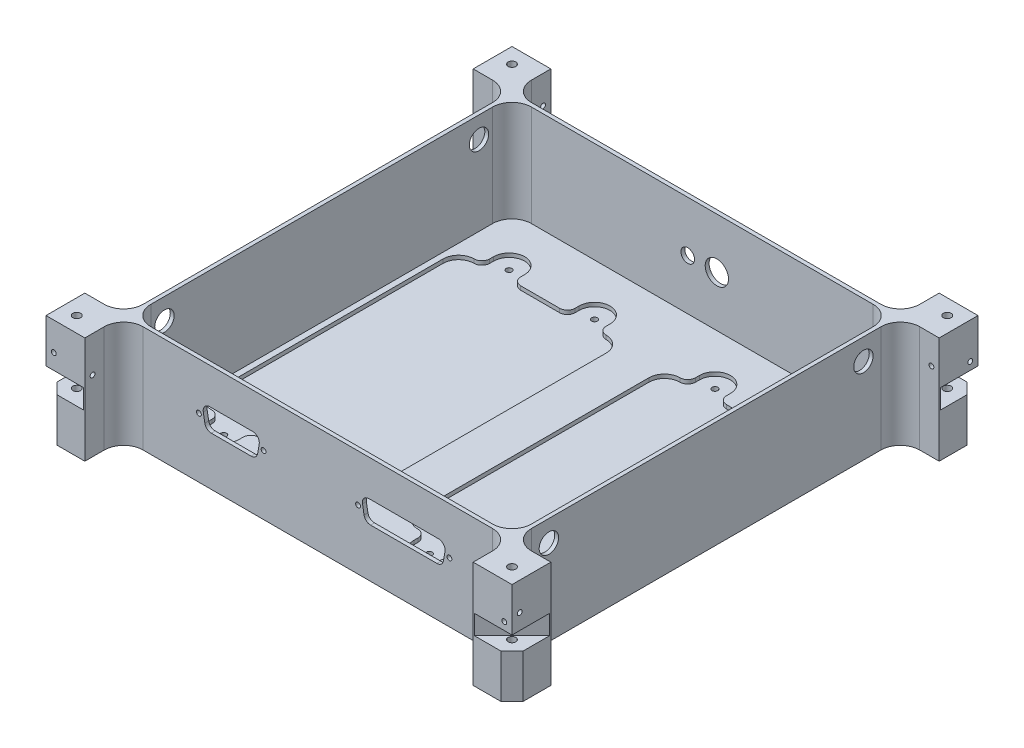
from build123d import *

# Parameters (mm, degrees)
BOSS_EXTRUDE1_DEPTH        = 27.5
CUT_EXTRUDE1_DEPTH         = 52
SKETCH3_R                  = 1.5
CUT_EXTRUDE2_DEPTH         = 2
BOSS_EXTRUDE2_DEPTH        = 2
CUT_EXTRUDE3_REACH         = 179.494
SKETCH3_3_R                = 1.5
CUT_EXTRUDE4_DEPTH         = 2
F_3_0_3_DIAMETER_HOLE1_D   = 3
F_10_0_10_DIAMETER_HOLE1_D = 10
CUT_EXTRUDE5_DEPTH         = 22.5
CIRPATTERN1_COUNT          = 4
CUT_EXTRUDE6_DEPTH         = 10
CIRPATTERN2_COUNT          = 4
CUT_EXTRUDE7_REACH         = 254.33
SKETCH18_R                 = 6
SKETCH18_R_2               = 3.5
SKETCH22_R                 = 2
CUT_EXTRUDE8_DEPTH         = 180.022344974
CIRPATTERN3_COUNT          = 4
M3X0_5_TAPPED_HOLE1_D      = 2.5
M3X0_5_TAPPED_HOLE1_DEPTH  = 20
M3X0_5_TAPPED_HOLE1_TIP    = 0.751075774
M3X0_5_TAPPED_HOLE2_D      = 2.5
M3X0_5_TAPPED_HOLE2_DEPTH  = 21.5
M3X0_5_TAPPED_HOLE2_TIP    = 0.751075774
M3X0_5_TAPPED_HOLE3_D      = 2.5
M3X0_5_TAPPED_HOLE3_DEPTH  = 21.5
M3X0_5_TAPPED_HOLE3_TIP    = 0.751075774
M3X0_5_TAPPED_HOLE4_D      = 2.5
M3X0_5_TAPPED_HOLE4_DEPTH  = 21.5
M3X0_5_TAPPED_HOLE4_TIP    = 0.751075774
CUT_EXTRUDE9_DEPTH         = 10
M3X0_5_TAPPED_HOLE5_D      = 2.5
M3X0_5_TAPPED_HOLE5_DEPTH  = 4
M3X0_5_TAPPED_HOLE5_TIP    = 0.751075774


with BuildPart() as part:
    # Sketch1 → Boss-Extrude1 (new, symmetric)
    with BuildSketch(Plane(origin=(0, 0, 0), x_dir=(1, 0, 0), z_dir=(0, 1, 0))):
        with BuildLine():
            Line((-100, 120), (-120, 120))
            Line((-120, 120), (-120, 100))
            Line((-120, 100), (-110, 100))
            ThreePointArc((-110, 100), (-102.928932188, 97.071067812), (-100, 90))
            Line((-100, 90), (-100, -90))
            ThreePointArc((-100, -90), (-102.928932188, -97.071067812), (-110, -100))
            Line((-110, -100), (-120, -100))
            Line((-120, -100), (-120, -120))
            Line((-120, -120), (-100, -120))
            Line((-100, -120), (-100, -110))
            ThreePointArc((-100, -110), (-97.071067812, -102.928932188), (-90, -100))
            Line((-90, -100), (90, -100))
            ThreePointArc((90, -100), (97.071067812, -102.928932188), (100, -110))
            Line((100, -110), (100, -120))
            Line((100, -120), (120, -120))
            Line((120, -120), (120, -100))
            Line((120, -100), (110, -100))
            ThreePointArc((110, -100), (102.928932188, -97.071067812), (100, -90))
            Line((100, -90), (100, 90))
            ThreePointArc((100, 90), (102.928932188, 97.071067812), (110, 100))
            Line((110, 100), (120, 100))
            Line((120, 100), (120, 120))
            Line((120, 120), (100, 120))
            Line((100, 120), (100, 110))
            ThreePointArc((100, 110), (97.071067812, 102.928932188), (90, 100))
            Line((90, 100), (-90, 100))
            ThreePointArc((-90, 100), (-97.071067812, 102.928932188), (-100, 110))
            Line((-100, 110), (-100, 120))
        make_face()
    extrude(amount=BOSS_EXTRUDE1_DEPTH, both=True)

    # Sketch2 → Cut-Extrude1 (cut)
    with BuildSketch(Plane(origin=(0, 27.5, 0), x_dir=(1, 0, 0), z_dir=(0, 1, 0))):
        with BuildLine():
            Line((-88, 98), (88, 98))
            ThreePointArc((88, 98), (95.071067812, 95.071067812), (98, 88))
            Line((98, 88), (98, -88))
            ThreePointArc((98, -88), (95.071067812, -95.071067812), (88, -98))
            Line((88, -98), (-88, -98))
            ThreePointArc((-88, -98), (-95.071067812, -95.071067812), (-98, -88))
            Line((-98, -88), (-98, 88))
            ThreePointArc((-98, 88), (-95.071067812, 95.071067812), (-88, 98))
        make_face()
    extrude(amount=-CUT_EXTRUDE1_DEPTH, mode=Mode.SUBTRACT)

    # Sketch3 → Cut-Extrude2 (cut)
    # profile 1 of 2: a face of its own
    with BuildSketch(Plane(origin=(0, -24.5, 0), x_dir=(1, 0, 0), z_dir=(0, 1, 0))):
        with BuildLine():
            ThreePointArc((-83, 71.5), (-84.171572875, 68.671572875), (-87, 67.5))
            ThreePointArc((-87, 67.5), (-92.656854249, 65.156854249), (-95, 59.5))
            Line((-95, 59.5), (-95, -59.5))
            ThreePointArc((-95, -59.5), (-92.656854249, -65.156854249), (-87, -67.5))
            ThreePointArc((-87, -67.5), (-84.171572875, -68.671572875), (-83, -71.5))
            Line((-83, -71.5), (-83, -73.5))
            ThreePointArc((-83, -73.5), (-75, -81.5), (-67, -73.5))
            Line((-67, -73.5), (-67, -71.5))
            ThreePointArc((-67, -71.5), (-65.828427125, -68.671572875), (-63, -67.5))
            Line((-63, -67.5), (-43, -67.5))
            ThreePointArc((-43, -67.5), (-40.171572875, -68.671572875), (-39, -71.5))
            Line((-39, -71.5), (-39, -73.5))
            ThreePointArc((-39, -73.5), (-31, -81.5), (-23, -73.5))
            Line((-23, -73.5), (-23, -71.5))
            ThreePointArc((-23, -71.5), (-21.828427125, -68.671572875), (-19, -67.5))
            ThreePointArc((-19, -67.5), (-13.343145751, -65.156854249), (-11, -59.5))
            Line((-11, -59.5), (-11, 59.5))
            ThreePointArc((-11, 59.5), (-13.343145751, 65.156854249), (-19, 67.5))
            ThreePointArc((-19, 67.5), (-21.828427125, 68.671572875), (-23, 71.5))
            Line((-23, 71.5), (-23, 73.5))
            ThreePointArc((-23, 73.5), (-31, 81.5), (-39, 73.5))
            Line((-39, 73.5), (-39, 71.5))
            ThreePointArc((-39, 71.5), (-40.171572875, 68.671572875), (-43, 67.5))
            Line((-43, 67.5), (-63, 67.5))
            ThreePointArc((-63, 67.5), (-65.828427125, 68.671572875), (-67, 71.5))
            Line((-67, 71.5), (-67, 73.5))
            ThreePointArc((-67, 73.5), (-75, 81.5), (-83, 73.5))
            Line((-83, 73.5), (-83, 71.5))
        make_face()
        with Locations(Location((-75, -73.5, 0), (0, 0, 270))):
            Circle(SKETCH3_R, mode=Mode.SUBTRACT)
        with Locations(Location((-31, -73.5, 0), (0, 0, 270))):
            Circle(SKETCH3_R, mode=Mode.SUBTRACT)
        with Locations(Location((-75, 73.5, 0), (0, 0, 270))):
            Circle(SKETCH3_R, mode=Mode.SUBTRACT)
        with Locations(Location((-31, 73.5, 0), (0, 0, 270))):
            Circle(SKETCH3_R, mode=Mode.SUBTRACT)
    # profile 2 of 2: a face of its own
    with BuildSketch(Plane(origin=(0, -24.5, 0), x_dir=(1, 0, 0), z_dir=(0, 1, 0))):
        with BuildLine():
            ThreePointArc((23, 71.5), (21.828427125, 68.671572875), (19, 67.5))
            ThreePointArc((19, 67.5), (13.343145751, 65.156854249), (11, 59.5))
            Line((11, 59.5), (11, -59.5))
            ThreePointArc((11, -59.5), (13.343145751, -65.156854249), (19, -67.5))
            ThreePointArc((19, -67.5), (21.828427125, -68.671572875), (23, -71.5))
            Line((23, -71.5), (23, -73.5))
            ThreePointArc((23, -73.5), (31, -81.5), (39, -73.5))
            Line((39, -73.5), (39, -71.5))
            ThreePointArc((39, -71.5), (40.171572875, -68.671572875), (43, -67.5))
            Line((43, -67.5), (63, -67.5))
            ThreePointArc((63, -67.5), (65.828427125, -68.671572875), (67, -71.5))
            Line((67, -71.5), (67, -73.5))
            ThreePointArc((67, -73.5), (75, -81.5), (83, -73.5))
            Line((83, -73.5), (83, -71.5))
            ThreePointArc((83, -71.5), (84.171572875, -68.671572875), (87, -67.5))
            ThreePointArc((87, -67.5), (92.656854249, -65.156854249), (95, -59.5))
            Line((95, -59.5), (95, 59.5))
            ThreePointArc((95, 59.5), (92.656854249, 65.156854249), (87, 67.5))
            ThreePointArc((87, 67.5), (84.171572875, 68.671572875), (83, 71.5))
            Line((83, 71.5), (83, 73.5))
            ThreePointArc((83, 73.5), (75, 81.5), (67, 73.5))
            Line((67, 73.5), (67, 71.5))
            ThreePointArc((67, 71.5), (65.828427125, 68.671572875), (63, 67.5))
            Line((63, 67.5), (43, 67.5))
            ThreePointArc((43, 67.5), (40.171572875, 68.671572875), (39, 71.5))
            Line((39, 71.5), (39, 73.5))
            ThreePointArc((39, 73.5), (31, 81.5), (23, 73.5))
            Line((23, 73.5), (23, 71.5))
        make_face()
        with Locations(Location((31, -73.5, 0), (0, 0, 270))):
            Circle(SKETCH3_R, mode=Mode.SUBTRACT)
        with Locations(Location((75, -73.5, 0), (0, 0, 270))):
            Circle(SKETCH3_R, mode=Mode.SUBTRACT)
        with Locations(Location((31, 73.5, 0), (0, 0, 270))):
            Circle(SKETCH3_R, mode=Mode.SUBTRACT)
        with Locations(Location((75, 73.5, 0), (0, 0, 270))):
            Circle(SKETCH3_R, mode=Mode.SUBTRACT)
    extrude(amount=-CUT_EXTRUDE2_DEPTH, mode=Mode.SUBTRACT)

    # Sketch5 → Boss-Extrude2 (add)
    with BuildSketch(Plane.XZ.offset(27.5)):
        with BuildLine():
            Line((-88, 98), (88, 98))
            ThreePointArc((88, 98), (95.071067812, 95.071067812), (98, 88))
            Line((98, 88), (98, -88))
            ThreePointArc((98, -88), (95.071067812, -95.071067812), (88, -98))
            Line((88, -98), (-88, -98))
            ThreePointArc((-88, -98), (-95.071067812, -95.071067812), (-98, -88))
            Line((-98, -88), (-98, 88))
            ThreePointArc((-98, 88), (-95.071067812, 95.071067812), (-88, 98))
        make_face()
    extrude(amount=BOSS_EXTRUDE2_DEPTH)

    # Sketch3<3> → Cut-Extrude3 (cut, up to next)
    with BuildSketch(Plane(origin=(0, -24.5, 0), x_dir=(1, 0, 0), z_dir=(0, 1, 0)), mode=Mode.PRIVATE) as cut_extrude3_sk1:
        with Locations(Location((-75, 73.5, 0), (0, 0, 270))):
            Circle(SKETCH3_3_R)
    cut_extrude3_tool1 = extrude(cut_extrude3_sk1.sketch, amount=-CUT_EXTRUDE3_REACH, mode=Mode.PRIVATE) & part.part
    # Sketch3<3> → Cut-Extrude3 (cut, up to next)
    with BuildSketch(Plane(origin=(0, -24.5, 0), x_dir=(1, 0, 0), z_dir=(0, 1, 0)), mode=Mode.PRIVATE) as cut_extrude3_sk2:
        with Locations(Location((-31, 73.5, 0), (0, 0, 270))):
            Circle(SKETCH3_3_R)
    cut_extrude3_tool2 = extrude(cut_extrude3_sk2.sketch, amount=-CUT_EXTRUDE3_REACH, mode=Mode.PRIVATE) & part.part
    # Sketch3<3> → Cut-Extrude3 (cut, up to next)
    with BuildSketch(Plane(origin=(0, -24.5, 0), x_dir=(1, 0, 0), z_dir=(0, 1, 0)), mode=Mode.PRIVATE) as cut_extrude3_sk3:
        with Locations(Location((-31, -73.5, 0), (0, 0, 270))):
            Circle(SKETCH3_3_R)
    cut_extrude3_tool3 = extrude(cut_extrude3_sk3.sketch, amount=-CUT_EXTRUDE3_REACH, mode=Mode.PRIVATE) & part.part
    # Sketch3<3> → Cut-Extrude3 (cut, up to next)
    with BuildSketch(Plane(origin=(0, -24.5, 0), x_dir=(1, 0, 0), z_dir=(0, 1, 0)), mode=Mode.PRIVATE) as cut_extrude3_sk4:
        with Locations(Location((-75, -73.5, 0), (0, 0, 270))):
            Circle(SKETCH3_3_R)
    cut_extrude3_tool4 = extrude(cut_extrude3_sk4.sketch, amount=-CUT_EXTRUDE3_REACH, mode=Mode.PRIVATE) & part.part
    # Sketch3<3> → Cut-Extrude3 (cut, up to next)
    with BuildSketch(Plane(origin=(0, -24.5, 0), x_dir=(1, 0, 0), z_dir=(0, 1, 0)), mode=Mode.PRIVATE) as cut_extrude3_sk5:
        with Locations(Location((75, -73.5, 0), (0, 0, 270))):
            Circle(SKETCH3_3_R)
    cut_extrude3_tool5 = extrude(cut_extrude3_sk5.sketch, amount=-CUT_EXTRUDE3_REACH, mode=Mode.PRIVATE) & part.part
    # Sketch3<3> → Cut-Extrude3 (cut, up to next)
    with BuildSketch(Plane(origin=(0, -24.5, 0), x_dir=(1, 0, 0), z_dir=(0, 1, 0)), mode=Mode.PRIVATE) as cut_extrude3_sk6:
        with Locations(Location((31, -73.5, 0), (0, 0, 270))):
            Circle(SKETCH3_3_R)
    cut_extrude3_tool6 = extrude(cut_extrude3_sk6.sketch, amount=-CUT_EXTRUDE3_REACH, mode=Mode.PRIVATE) & part.part
    # Sketch3<3> → Cut-Extrude3 (cut, up to next)
    with BuildSketch(Plane(origin=(0, -24.5, 0), x_dir=(1, 0, 0), z_dir=(0, 1, 0)), mode=Mode.PRIVATE) as cut_extrude3_sk7:
        with Locations(Location((31, 73.5, 0), (0, 0, 270))):
            Circle(SKETCH3_3_R)
    cut_extrude3_tool7 = extrude(cut_extrude3_sk7.sketch, amount=-CUT_EXTRUDE3_REACH, mode=Mode.PRIVATE) & part.part
    # Sketch3<3> → Cut-Extrude3 (cut, up to next)
    with BuildSketch(Plane(origin=(0, -24.5, 0), x_dir=(1, 0, 0), z_dir=(0, 1, 0)), mode=Mode.PRIVATE) as cut_extrude3_sk8:
        with Locations(Location((75, 73.5, 0), (0, 0, 270))):
            Circle(SKETCH3_3_R)
    cut_extrude3_tool8 = extrude(cut_extrude3_sk8.sketch, amount=-CUT_EXTRUDE3_REACH, mode=Mode.PRIVATE) & part.part
    add(cut_extrude3_tool1.solids().sort_by_distance((-75, -24.5, -73.5))[0], mode=Mode.SUBTRACT)
    add(cut_extrude3_tool2.solids().sort_by_distance((-31, -24.5, -73.5))[0], mode=Mode.SUBTRACT)
    add(cut_extrude3_tool3.solids().sort_by_distance((-31, -24.5, 73.5))[0], mode=Mode.SUBTRACT)
    add(cut_extrude3_tool4.solids().sort_by_distance((-75, -24.5, 73.5))[0], mode=Mode.SUBTRACT)
    add(cut_extrude3_tool5.solids().sort_by_distance((75, -24.5, 73.5))[0], mode=Mode.SUBTRACT)
    add(cut_extrude3_tool6.solids().sort_by_distance((31, -24.5, 73.5))[0], mode=Mode.SUBTRACT)
    add(cut_extrude3_tool7.solids().sort_by_distance((31, -24.5, -73.5))[0], mode=Mode.SUBTRACT)
    add(cut_extrude3_tool8.solids().sort_by_distance((75, -24.5, -73.5))[0], mode=Mode.SUBTRACT)

    # Sketch4 → Cut-Extrude4 (cut)
    with BuildSketch(Plane.XZ.offset(29.5)):
        with BuildLine():
            ThreePointArc((8, -59.5), (10.182959751, -66.077218352), (15.865418408, -70.043927079))
            ThreePointArc((15.865418408, -70.043927079), (18.857472547, -72.067850941), (20.145290356, -75.442785172))
            Line((20.145290356, -75.442785172), (20.172634951, -75.441176471))
            ThreePointArc((20.172634951, -75.441176471), (31, -84.5), (41.827365049, -75.441176471))
            ThreePointArc((41.827365049, -75.441176471), (43.883066843, -71.898210067), (47.733200531, -70.5))
            Line((47.733200531, -70.5), (58.266799469, -70.5))
            ThreePointArc((58.266799469, -70.5), (62.116933157, -71.898210067), (64.172634951, -75.441176471))
            ThreePointArc((64.172634951, -75.441176471), (72.675795677, -84.25165449), (84.058823529, -79.740009316))
            ThreePointArc((84.058823529, -79.740009316), (90.782265577, -77.414468497), (95, -83.143650761))
            Line((95, -83.143650761), (95, -88))
            ThreePointArc((95, -88), (92.949747468, -92.949747468), (88, -95))
            Line((88, -95), (-88, -95))
            ThreePointArc((-88, -95), (-92.949747468, -92.949747468), (-95, -88))
            Line((-95, -88), (-95, -83.143650761))
            ThreePointArc((-95, -83.143650761), (-90.782265577, -77.414468497), (-84.058823529, -79.740009316))
            ThreePointArc((-84.058823529, -79.740009316), (-72.675795677, -84.25165449), (-64.172634951, -75.441176471))
            ThreePointArc((-64.172634951, -75.441176471), (-62.116933157, -71.898210067), (-58.266799469, -70.5))
            Line((-58.266799469, -70.5), (-47.733200531, -70.5))
            ThreePointArc((-47.733200531, -70.5), (-43.883066843, -71.898210067), (-41.827365049, -75.441176471))
            ThreePointArc((-41.827365049, -75.441176471), (-31, -84.5), (-20.172634951, -75.441176471))
            Line((-20.172634951, -75.441176471), (-20.145290356, -75.442785172))
            ThreePointArc((-20.145290356, -75.442785172), (-18.857472547, -72.067850941), (-15.865418408, -70.043927079))
            ThreePointArc((-15.865418408, -70.043927079), (-10.182959751, -66.077218352), (-8, -59.5))
            Line((-8, -59.5), (-8, 59.5))
            ThreePointArc((-8, 59.5), (-10.182959751, 66.077218352), (-15.865418408, 70.043927079))
            ThreePointArc((-15.865418408, 70.043927079), (-18.857472547, 72.067850941), (-20.145290356, 75.442785172))
            Line((-20.145290356, 75.442785172), (-20.172634951, 75.441176471))
            ThreePointArc((-20.172634951, 75.441176471), (-31, 84.5), (-41.827365049, 75.441176471))
            ThreePointArc((-41.827365049, 75.441176471), (-43.883066843, 71.898210067), (-47.733200531, 70.5))
            Line((-47.733200531, 70.5), (-58.266799469, 70.5))
            ThreePointArc((-58.266799469, 70.5), (-62.116933157, 71.898210067), (-64.172634951, 75.441176471))
            ThreePointArc((-64.172634951, 75.441176471), (-72.675795677, 84.25165449), (-84.058823529, 79.740009316))
            ThreePointArc((-84.058823529, 79.740009316), (-90.782265577, 77.414468497), (-95, 83.143650761))
            Line((-95, 83.143650761), (-95, 88))
            ThreePointArc((-95, 88), (-92.949747468, 92.949747468), (-88, 95))
            Line((-88, 95), (88, 95))
            ThreePointArc((88, 95), (92.949747468, 92.949747468), (95, 88))
            Line((95, 88), (95, 83.143650761))
            ThreePointArc((95, 83.143650761), (90.782265577, 77.414468497), (84.058823529, 79.740009316))
            ThreePointArc((84.058823529, 79.740009316), (72.675795677, 84.25165449), (64.172634951, 75.441176471))
            ThreePointArc((64.172634951, 75.441176471), (62.116933157, 71.898210067), (58.266799469, 70.5))
            Line((58.266799469, 70.5), (47.733200531, 70.5))
            ThreePointArc((47.733200531, 70.5), (43.883066843, 71.898210067), (41.827365049, 75.441176471))
            ThreePointArc((41.827365049, 75.441176471), (31, 84.5), (20.172634951, 75.441176471))
            Line((20.172634951, 75.441176471), (20.145290356, 75.442785172))
            ThreePointArc((20.145290356, 75.442785172), (18.857472547, 72.067850941), (15.865418408, 70.043927079))
            ThreePointArc((15.865418408, 70.043927079), (10.182959751, 66.077218352), (8, 59.5))
            Line((8, 59.5), (8, -59.5))
        make_face()
    extrude(amount=-CUT_EXTRUDE4_DEPTH, mode=Mode.SUBTRACT)

    # Ø3.0 (3) Diameter Hole1 (through all)
    with Locations(Plane(origin=(0, -24.5, 0), x_dir=(1, 0, 0), z_dir=(0, 1, 0))):
        with Locations((-88, -81), (0, -81), (88, -81)):
            Hole(F_3_0_3_DIAMETER_HOLE1_D / 2)

    # Ø10.0 (10) Diameter Hole1 (through all)
    with Locations(Plane(origin=(100, 0, 0), x_dir=(0, 0, -1), z_dir=(1, 0, 0))):
        with Locations((-81, 16.5), (81, 16.5)):
            Hole(F_10_0_10_DIAMETER_HOLE1_D / 2)

    # Sketch16 → Cut-Extrude5 (cut)
    with BuildSketch(Plane.XZ.offset(27.5)):
        Polygon((-114.343145751, -120), (-120, -114.343145751), (-120, -120), align=None)
    cut_extrude5 = extrude(amount=-CUT_EXTRUDE5_DEPTH, mode=Mode.SUBTRACT)

    # CirPattern1: Cut-Extrude5 ×4 about axis
    cirpattern1_axis = Axis((0, 0, 0), (0, 1, 0))
    for i in range(1, CIRPATTERN1_COUNT):
        add(cut_extrude5.rotate(cirpattern1_axis, i * 360 / CIRPATTERN1_COUNT), mode=Mode.SUBTRACT)

    # Sketch17 → Cut-Extrude6 (cut)
    with BuildSketch(Plane(origin=(0, -5, 0), x_dir=(-1, 0, 0), z_dir=(0, -1, 0))):
        Polygon((-114.343145751, 120), (-120, 120), (-120, 114.343145751), (-120, 100.61113206), (-100.61113206, 120), align=None)
    cut_extrude6 = extrude(amount=-CUT_EXTRUDE6_DEPTH, mode=Mode.SUBTRACT)

    # CirPattern2: Cut-Extrude6 ×4 about axis
    cirpattern2_axis = Axis((0, 0, 0), (0, 1, 0))
    for i in range(1, CIRPATTERN2_COUNT):
        add(cut_extrude6.rotate(cirpattern2_axis, i * 360 / CIRPATTERN2_COUNT), mode=Mode.SUBTRACT)

    # Sketch18 → Cut-Extrude7 (cut, up to next)
    with BuildSketch(Plane(origin=(0, 0, -100), x_dir=(-1, 0, 0), z_dir=(0, 0, -1)), mode=Mode.PRIVATE) as cut_extrude7_sk1:
        with Locations((-7.5, 1.5)):
            Circle(SKETCH18_R)
    cut_extrude7_tool1 = extrude(cut_extrude7_sk1.sketch, amount=-CUT_EXTRUDE7_REACH, mode=Mode.PRIVATE) & part.part
    # Sketch18 → Cut-Extrude7 (cut, up to next)
    with BuildSketch(Plane(origin=(0, 0, -100), x_dir=(-1, 0, 0), z_dir=(0, 0, -1)), mode=Mode.PRIVATE) as cut_extrude7_sk2:
        with Locations((7.5, 1.5)):
            Circle(SKETCH18_R_2)
    cut_extrude7_tool2 = extrude(cut_extrude7_sk2.sketch, amount=-CUT_EXTRUDE7_REACH, mode=Mode.PRIVATE) & part.part
    add(cut_extrude7_tool1.solids().sort_by_distance((7.5, 1.5, -100))[0], mode=Mode.SUBTRACT)
    add(cut_extrude7_tool2.solids().sort_by_distance((-7.5, 1.5, -100))[0], mode=Mode.SUBTRACT)

    # Sketch22 → Cut-Extrude8 (cut, through all)
    with BuildSketch(Plane(origin=(0, 27.5, 0), x_dir=(1, 0, 0), z_dir=(0, 1, 0))):
        with Locations(Location((-112.076424818, 112.076424818, 0), (0, 0, 270))):
            Circle(SKETCH22_R)
    cut_extrude8 = extrude(amount=-CUT_EXTRUDE8_DEPTH, mode=Mode.SUBTRACT)

    # CirPattern3: Cut-Extrude8 ×4 about axis
    cirpattern3_axis = Axis((0, 0, 0), (0, 1, 0))
    for i in range(1, CIRPATTERN3_COUNT):
        add(cut_extrude8.rotate(cirpattern3_axis, i * 360 / CIRPATTERN3_COUNT), mode=Mode.SUBTRACT)

    # M3x0.5 Tapped Hole1
    with Locations(Plane.ZY.offset(120)):
        with Locations((-116, 13), (116, 9)):
            Hole(M3X0_5_TAPPED_HOLE1_D / 2, depth=M3X0_5_TAPPED_HOLE1_DEPTH)
            with Locations((0, 0, -(M3X0_5_TAPPED_HOLE1_DEPTH + M3X0_5_TAPPED_HOLE1_TIP / 2))):  # 118° drill point
                Cone(0, M3X0_5_TAPPED_HOLE1_D / 2, M3X0_5_TAPPED_HOLE1_TIP, mode=Mode.SUBTRACT)

    # M3x0.5 Tapped Hole2
    with Locations(Plane.XY.offset(120)):
        with Locations((-116, 13), (116, 9)):
            Hole(M3X0_5_TAPPED_HOLE2_D / 2, depth=M3X0_5_TAPPED_HOLE2_DEPTH)
            with Locations((0, 0, -(M3X0_5_TAPPED_HOLE2_DEPTH + M3X0_5_TAPPED_HOLE2_TIP / 2))):  # 118° drill point
                Cone(0, M3X0_5_TAPPED_HOLE2_D / 2, M3X0_5_TAPPED_HOLE2_TIP, mode=Mode.SUBTRACT)

    # M3x0.5 Tapped Hole3
    with Locations(Plane(origin=(120, 0, 0), x_dir=(0, 0, -1), z_dir=(1, 0, 0))):
        with Locations((-116, 13), (116, 9)):
            Hole(M3X0_5_TAPPED_HOLE3_D / 2, depth=M3X0_5_TAPPED_HOLE3_DEPTH)
            with Locations((0, 0, -(M3X0_5_TAPPED_HOLE3_DEPTH + M3X0_5_TAPPED_HOLE3_TIP / 2))):  # 118° drill point
                Cone(0, M3X0_5_TAPPED_HOLE3_D / 2, M3X0_5_TAPPED_HOLE3_TIP, mode=Mode.SUBTRACT)

    # M3x0.5 Tapped Hole4
    with Locations(Plane(origin=(0, 0, -120), x_dir=(-1, 0, 0), z_dir=(0, 0, -1))):
        with Locations((-116, 13), (116, 9)):
            Hole(M3X0_5_TAPPED_HOLE4_D / 2, depth=M3X0_5_TAPPED_HOLE4_DEPTH)
            with Locations((0, 0, -(M3X0_5_TAPPED_HOLE4_DEPTH + M3X0_5_TAPPED_HOLE4_TIP / 2))):  # 118° drill point
                Cone(0, M3X0_5_TAPPED_HOLE4_D / 2, M3X0_5_TAPPED_HOLE4_TIP, mode=Mode.SUBTRACT)

    # Sketch31 → Cut-Extrude9 (cut)
    with BuildSketch(Plane.XY.offset(100)):
        with BuildLine():
            Line((-55.65165364, 9), (-33.54834636, 9))
            ThreePointArc((-33.54834636, 9), (-30.943795254, 7.785477873), (-30.2, 5.009596196))
            Line((-30.2, 5.009596196), (-31.011104111, 0.409596196))
            ThreePointArc((-31.011104111, 0.409596196), (-32.173972599, -1.604551107), (-34.359450472, -2.4))
            Line((-34.359450472, -2.4), (-54.840549528, -2.4))
            ThreePointArc((-54.840549528, -2.4), (-57.026027401, -1.604551107), (-58.188895889, 0.409596196))
            Line((-58.188895889, 0.409596196), (-59, 5.009596196))
            ThreePointArc((-59, 5.009596196), (-58.256204746, 7.785477873), (-55.65165364, 9))
        make_face()
        with BuildLine():
            Line((26.34834636, 9), (62.15165364, 9))
            ThreePointArc((62.15165364, 9), (64.756204746, 7.785477873), (65.5, 5.009596196))
            Line((65.5, 5.009596196), (64.688895889, 0.409596196))
            ThreePointArc((64.688895889, 0.409596196), (63.526027401, -1.604551107), (61.340549528, -2.4))
            Line((61.340549528, -2.4), (27.159450472, -2.4))
            ThreePointArc((27.159450472, -2.4), (24.973972599, -1.604551107), (23.811104111, 0.409596196))
            Line((23.811104111, 0.409596196), (23, 5.009596196))
            ThreePointArc((23, 5.009596196), (23.743795254, 7.785477873), (26.34834636, 9))
        make_face()
    extrude(amount=-CUT_EXTRUDE9_DEPTH, mode=Mode.SUBTRACT)

    # M3x0.5 Tapped Hole5
    with Locations(Plane.XY.offset(100)):
        with Locations((-61.25165364, 3.3), (-27.95165364, 3.3), (20.72834636, 3.3), (67.76834636, 3.3)):
            Hole(M3X0_5_TAPPED_HOLE5_D / 2, depth=M3X0_5_TAPPED_HOLE5_DEPTH)
            with Locations((0, 0, -(M3X0_5_TAPPED_HOLE5_DEPTH + M3X0_5_TAPPED_HOLE5_TIP / 2))):  # 118° drill point
                Cone(0, M3X0_5_TAPPED_HOLE5_D / 2, M3X0_5_TAPPED_HOLE5_TIP, mode=Mode.SUBTRACT)


solid = part.part
